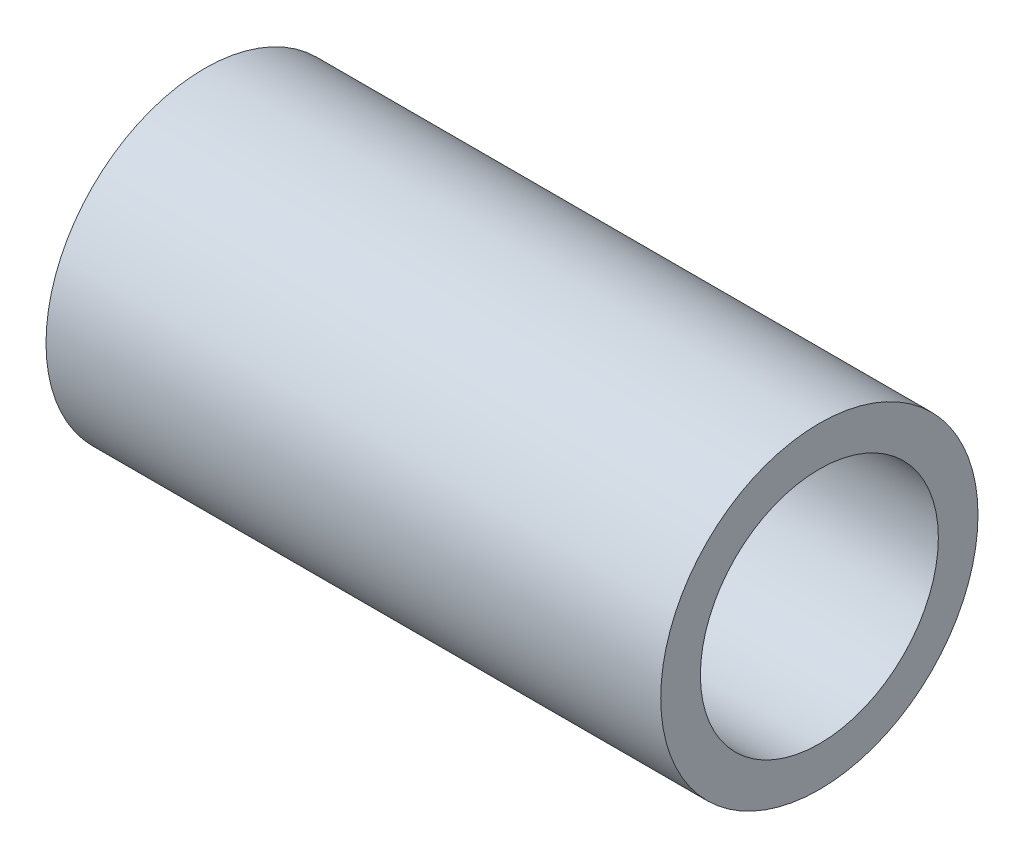
from build123d import *

# Parameters (mm, degrees)
SKETCH1_W = 15.5
SKETCH1_H = 4


with BuildPart() as part:
    # Sketch1 → Revolve1 (revolve)
    with BuildSketch(Plane.XY, mode=Mode.PRIVATE) as revolve1_sk:
        with Locations((7.75, 2)):
            Rectangle(SKETCH1_W, SKETCH1_H)
    revolve(revolve1_sk.sketch.rotate(Axis((0, 0, 0), (1, 0, 0)), 90), axis=Axis((0, 0, 0), (1, 0, 0)))

    # SurfaceCut1: cut with a surface, the side it looks to stays
    # Surface-Revolve1: a surface, the sketch's curves turned about an axis
    with BuildLine(Plane.XY, mode=Mode.PRIVATE) as surface_revolve1_1_path:
        Line((0, 3), (15.5, 3))
    surface_revolve1_1 = Shell.revolve(surface_revolve1_1_path.wire(), 360, Axis((0, 0, 0), (1, 0, 0)))
    split(bisect_by=surface_revolve1_1, keep=Keep.TOP)


solid = part.part
